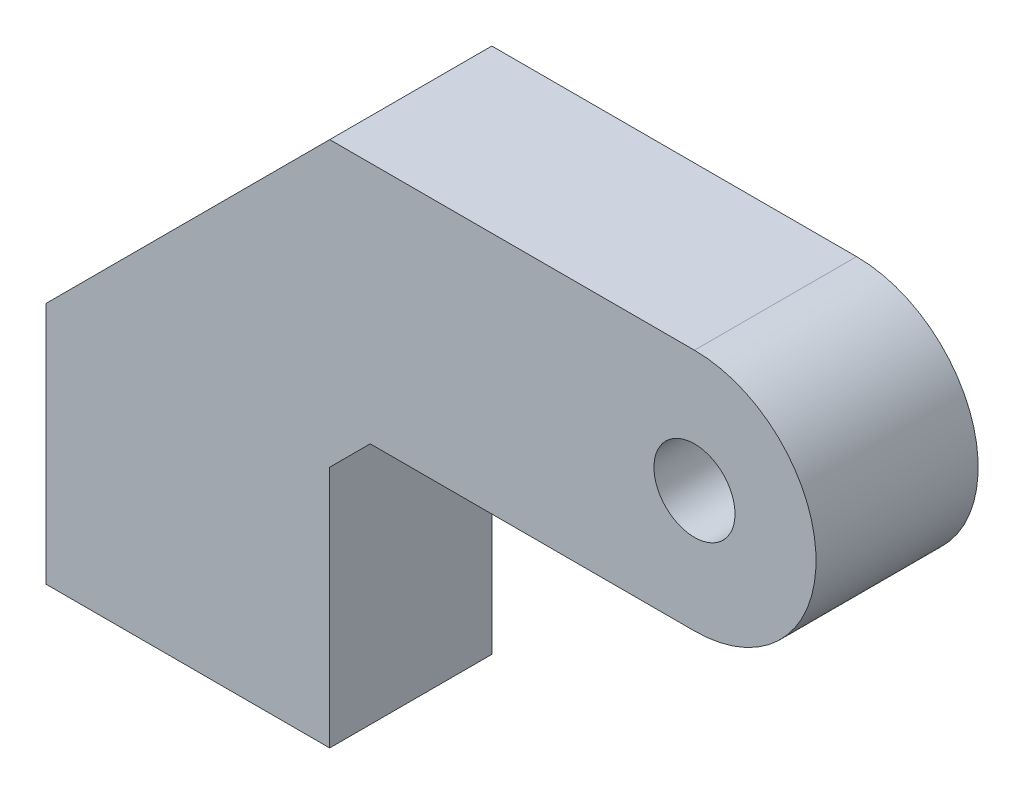
from build123d import *

# Parameters (mm, degrees)
ESQUISSE1_W             = 14
ESQUISSE1_H             = 26
BOSS_EXTRU_1_DEPTH      = 8
ESQUISSE3_R             = 1.25
ENL_V_MAT_EXTRU_1_DEPTH = 10
ESQUISSE4_W             = 24
ESQUISSE4_H             = 12
BOSS_EXTRU_2_DEPTH      = 8
ESQUISSE5_R             = 2
ENL_V_MAT_EXTRU_2_DEPTH = 42.243181255
CHANFREIN1_SIZE         = 14
ENL_V_MAT_EXTRU_3_DEPTH = 42.243181255
CHANFREIN2_SIZE         = 2


with BuildPart() as part:
    # Esquisse1 → Boss.-Extru.1 (new body)
    with BuildSketch(Plane.XY):
        with Locations((0, 13)):
            Rectangle(ESQUISSE1_W, ESQUISSE1_H)
    extrude(amount=BOSS_EXTRU_1_DEPTH)

    # Esquisse3 → Enlèv. mat.-Extru.1 (cut)
    with BuildSketch(Plane(origin=(0, 0, 0), x_dir=(-1, 0, 0), z_dir=(0, -1, 0))):
        with Locations(Location((4, -4, 0), (0, 0, 180))):
            Circle(ESQUISSE3_R)
        with Locations((-4, -4)):
            Circle(ESQUISSE3_R)
    extrude(amount=-ENL_V_MAT_EXTRU_1_DEPTH, mode=Mode.SUBTRACT)

    # Esquisse4 → Boss.-Extru.2 (add)
    with BuildSketch(Plane.XY.offset(8)):
        with Locations((19, 20)):
            Rectangle(ESQUISSE4_W, ESQUISSE4_H)
    extrude(amount=-BOSS_EXTRU_2_DEPTH)

    # Esquisse5 → Enlèv. mat.-Extru.2 (cut, through all)
    with BuildSketch(Plane.XY.offset(8)):
        with Locations((25, 20)):
            Circle(ESQUISSE5_R)
    extrude(amount=-ENL_V_MAT_EXTRU_2_DEPTH, mode=Mode.SUBTRACT)

    # Chanfrein1
    chanfrein1_edges = [part.edges().sort_by_distance(p)[0] for p in [
        (-7, 26, 4),
    ]]
    chamfer(chanfrein1_edges, length=CHANFREIN1_SIZE)

    # Esquisse6 → Enlèv. mat.-Extru.3 (cut, through all)
    with BuildSketch(Plane.XY.offset(8)):
        with BuildLine():
            Line((25, 26), (32, 26))
            Line((32, 26), (32, 14))
            Line((32, 14), (25, 14))
            ThreePointArc((25, 14), (31, 20), (25, 26))
        make_face()
    extrude(amount=-ENL_V_MAT_EXTRU_3_DEPTH, mode=Mode.SUBTRACT)

    # Chanfrein2
    chanfrein2_edges = [part.edges().sort_by_distance(p)[0] for p in [
        (7, 14, 4),
    ]]
    chamfer(chanfrein2_edges, length=CHANFREIN2_SIZE)


solid = part.part
